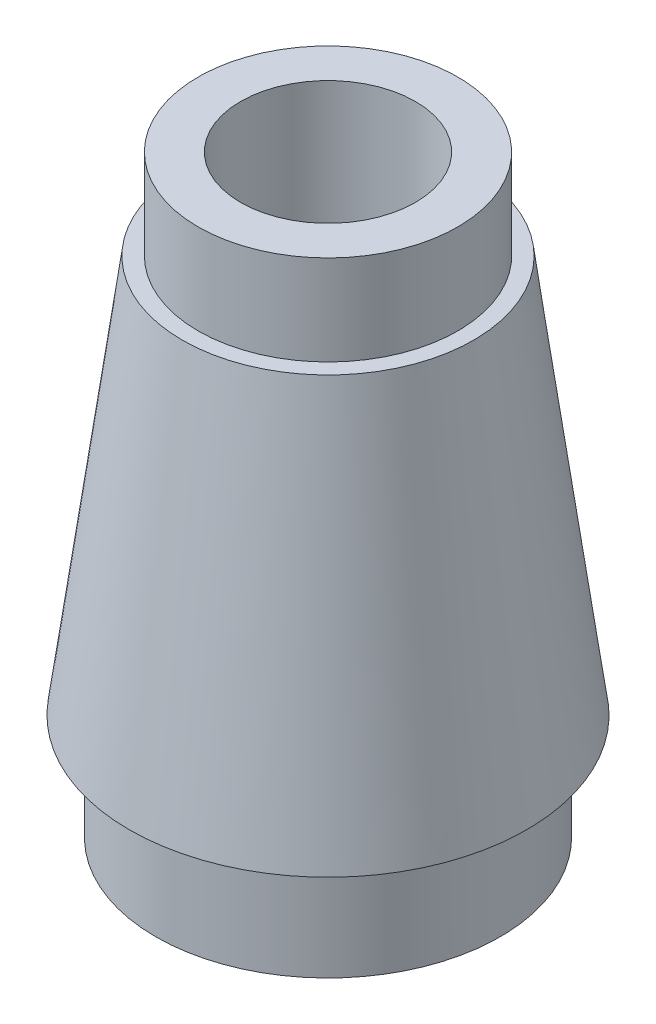
from build123d import *

# Parameters (mm, degrees)
SKETCH2_R           = 2.75
SKETCH1_R           = 3.75
SKETCH3_R           = 2.45
SKETCH3_R_2         = 1.65
BOSS_EXTRUDE1_DEPTH = 1.7
BOSS_EXTRUDE2_START = 2
SKETCH4_R           = 3.25
SKETCH4_R_2         = 2.45
BOSS_EXTRUDE2_DEPTH = 2
SKETCH5_R           = 1.65
CUT_EXTRUDE1_DEPTH  = 11.880027642


with BuildPart() as part:
    # Sketch2 → Loft1 section 0
    with BuildSketch(Plane(origin=(0, 7.5, 0), x_dir=(1, 0, 0), z_dir=(0, 1, 0))):
        Circle(SKETCH2_R)
    # Sketch1 → Loft1 section 1
    with BuildSketch(Plane(origin=(0, 0, 0), x_dir=(1, 0, 0), z_dir=(0, 1, 0))):
        Circle(SKETCH1_R)
    loft()

    # Sketch3 → Boss-Extrude1 (add)
    with BuildSketch(Plane(origin=(0, 7.5, 0), x_dir=(1, 0, 0), z_dir=(0, 1, 0))):
        with Locations(Location((0, 0, 0), (0, 0, 270))):
            Circle(SKETCH3_R)
        with Locations(Location((0, 0, 0), (0, 0, 270))):
            Circle(SKETCH3_R_2, mode=Mode.SUBTRACT)
    extrude(amount=BOSS_EXTRUDE1_DEPTH)

    # Sketch4 → Boss-Extrude2 (add)
    with BuildSketch(Plane.XZ.offset(BOSS_EXTRUDE2_START)):
        with Locations(Location((0, 0, 0), (0, 0, 90))):
            Circle(SKETCH4_R)
        with Locations(Location((0, 0, 0), (0, 0, 90))):
            Circle(SKETCH4_R_2, mode=Mode.SUBTRACT)
    extrude(amount=-BOSS_EXTRUDE2_DEPTH)

    # Sketch5 → Cut-Extrude1 (cut, through all)
    with BuildSketch(Plane(origin=(0, 7.5, 0), x_dir=(1, 0, 0), z_dir=(0, 1, 0))):
        with Locations(Location((0, 0, 0), (0, 0, 270))):
            Circle(SKETCH5_R)
    extrude(amount=-CUT_EXTRUDE1_DEPTH, mode=Mode.SUBTRACT)


solid = part.part
